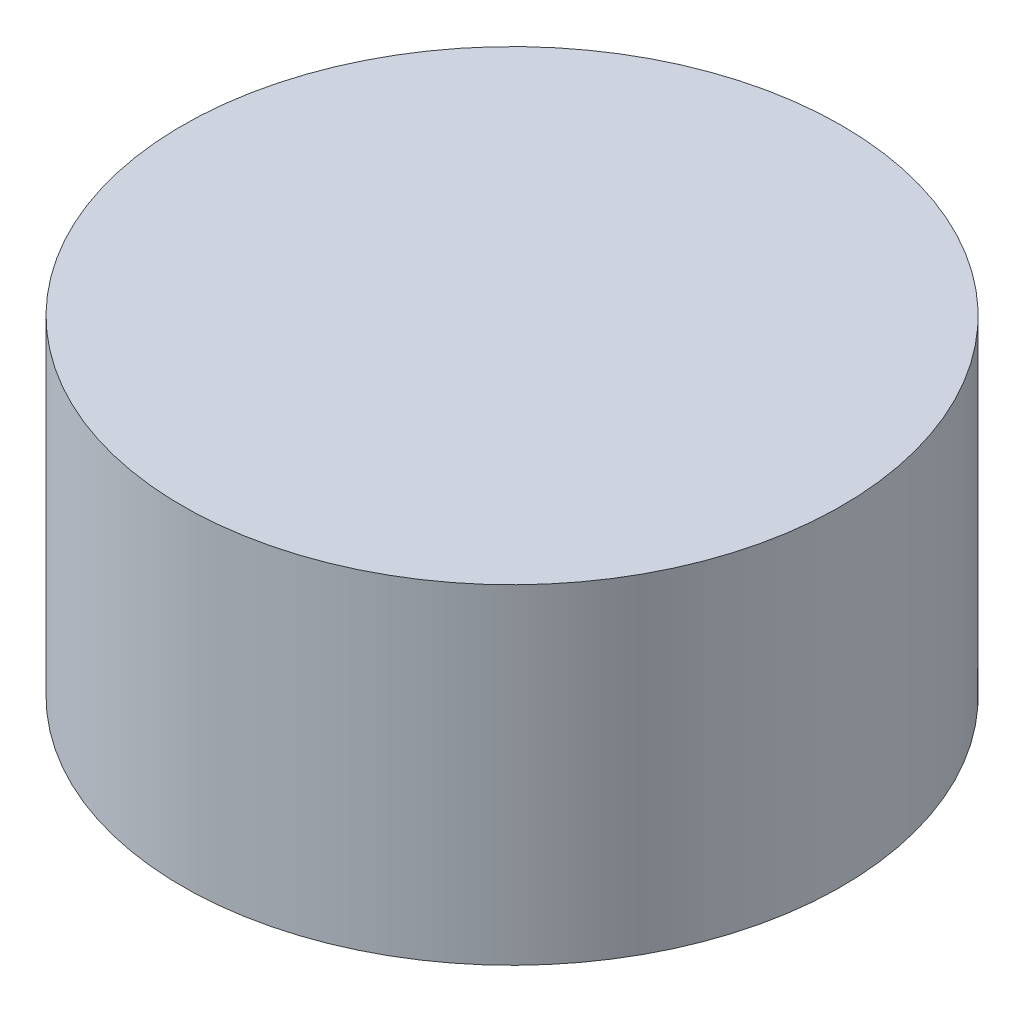
from build123d import *

# Parameters (mm, degrees)
SKETCH1_R           = 38.1
BOSS_EXTRUDE1_DEPTH = 38.1


with BuildPart() as part:
    # Sketch1 → Boss-Extrude1 (new body)
    with BuildSketch(Plane(origin=(0, 0, 0), x_dir=(1, 0, 0), z_dir=(0, 1, 0))):
        with Locations(Location((0, 0, 0), (0, 0, 90))):
            Circle(SKETCH1_R)
    extrude(amount=BOSS_EXTRUDE1_DEPTH)


solid = part.part
